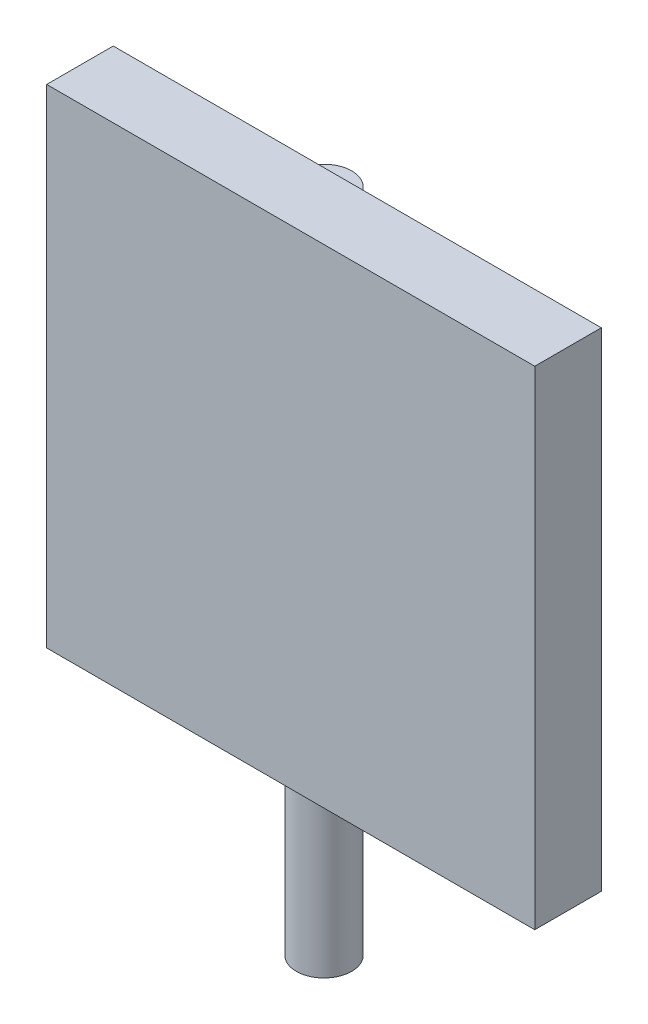
from build123d import *

# Parameters (mm, degrees)
SKETCH1_W                = 4
SKETCH1_H                = 4
BOSS_EXTRUDE1_DEPTH      = 0.1
BOSS_EXTRUDE2_DEPTH      = 4
BOSS_EXTRUDE2_DEPTH_BACK = 2
SKETCH2_R                = 0.25
SKETCH3_R                = 0.25
BOSS_EXTRUDE3_DEPTH      = 0.5
BOSS_EXTRUDE3_TAPER      = 3
SKETCH4_W                = 4.4
SKETCH4_H                = 4.4
BOSS_EXTRUDE4_DEPTH      = 0.3


with BuildPart() as part:
    # Sketch1 → Boss-Extrude1 (new, symmetric)
    with BuildSketch(Plane.XY):
        with Locations((0, 2)):
            Rectangle(SKETCH1_W, SKETCH1_H)
    extrude(amount=BOSS_EXTRUDE1_DEPTH, both=True)

    # Sketch3 → Boss-Extrude3 (add)
    with BuildSketch(Plane(origin=(0, 0, -0.1), x_dir=(-1, 0, 0), z_dir=(0, 0, -1))):
        with Locations((0.725, 3)):
            Circle(SKETCH3_R)
    extrude(amount=BOSS_EXTRUDE3_DEPTH, taper=BOSS_EXTRUDE3_TAPER)



with BuildPart() as body_2:
    # Sketch2 → Boss-Extrude2 (new, two sides: drawn at the far end of the back side and taken through both)
    with BuildSketch(Plane(origin=(0, 0, 0), x_dir=(1, 0, 0), z_dir=(0, 1, 0)).offset(-BOSS_EXTRUDE2_DEPTH_BACK)):
        with Locations(Location((-0.35, 0.35, 0), (0, 0, 270))):
            Circle(SKETCH2_R)
    extrude(amount=BOSS_EXTRUDE2_DEPTH + BOSS_EXTRUDE2_DEPTH_BACK)


with BuildPart() as part_1:
    add(part.part)

    add(body_2.part)  # Boss-Extrude4 merges body 2
    # Sketch4 → Boss-Extrude4 (add, symmetric)
    with BuildSketch(Plane.XY):
        with Locations((0, 2)):
            Rectangle(SKETCH4_W, SKETCH4_H)
    extrude(amount=BOSS_EXTRUDE4_DEPTH, both=True)


solid = part_1.part
